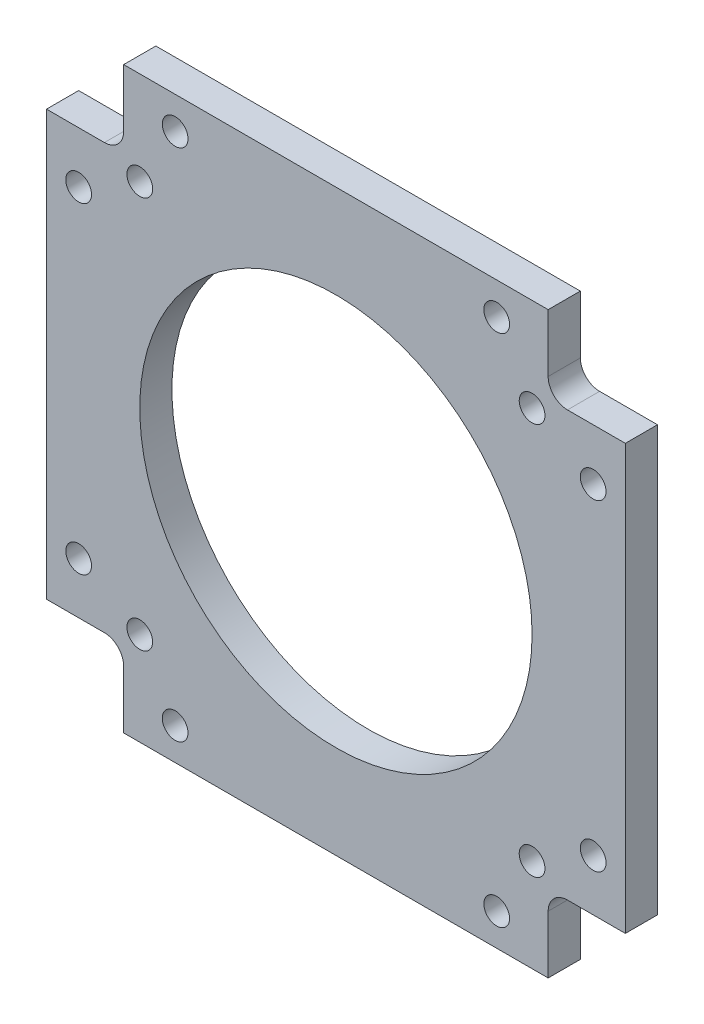
from build123d import *

# Parameters (mm, degrees)
SKETCH1_R           = 30.5
SKETCH1_R_2         = 2
BOSS_EXTRUDE1_DEPTH = 5
FILLET1_R           = 3
CUT_EXTRUDE1_REACH  = 65.836
SKETCH2_R           = 2


with BuildPart() as part:
    # Sketch1 → Boss-Extrude1 (new body)
    with BuildSketch(Plane.XY):
        Polygon((33, -45), (-33, -45), (-33, -33), (-45, -33), (-45, 33), (-33, 33), (-33, 45), (33, 45), (33, 33), (45, 33), (45, -33), (33, -33), align=None)
        Circle(SKETCH1_R, mode=Mode.SUBTRACT)
        with Locations((-30.5, 30.5)):
            Circle(SKETCH1_R_2, mode=Mode.SUBTRACT)
        with Locations(Location((30.5, 30.5, 0), (0, 0, 180))):
            Circle(SKETCH1_R_2, mode=Mode.SUBTRACT)
        with Locations((30.5, -30.5)):
            Circle(SKETCH1_R_2, mode=Mode.SUBTRACT)
        with Locations(Location((-30.5, -30.5, 0), (0, 0, 180))):
            Circle(SKETCH1_R_2, mode=Mode.SUBTRACT)
    extrude(amount=BOSS_EXTRUDE1_DEPTH)

    # Fillet1
    fillet1_edges = [part.edges().sort_by_distance(p)[0] for p in [
        (33, 33, 2.5),
        (33, -33, 2.5),
        (-33, -33, 2.5),
        (-33, 33, 2.5),
    ]]
    fillet(fillet1_edges, radius=FILLET1_R)

    # Sketch2 → Cut-Extrude1 (cut, up to next)
    with BuildSketch(Plane(origin=(0, 0, 0), x_dir=(-1, 0, 0), z_dir=(0, 0, -1)), mode=Mode.PRIVATE) as cut_extrude1_sk1:
        with Locations((-25, 40)):
            Circle(SKETCH2_R)
    cut_extrude1_tool1 = extrude(cut_extrude1_sk1.sketch, amount=-CUT_EXTRUDE1_REACH, mode=Mode.PRIVATE) & part.part
    # Sketch2 → Cut-Extrude1 (cut, up to next)
    with BuildSketch(Plane(origin=(0, 0, 0), x_dir=(-1, 0, 0), z_dir=(0, 0, -1)), mode=Mode.PRIVATE) as cut_extrude1_sk2:
        with Locations((40, 25)):
            Circle(SKETCH2_R)
    cut_extrude1_tool2 = extrude(cut_extrude1_sk2.sketch, amount=-CUT_EXTRUDE1_REACH, mode=Mode.PRIVATE) & part.part
    # Sketch2 → Cut-Extrude1 (cut, up to next)
    with BuildSketch(Plane(origin=(0, 0, 0), x_dir=(-1, 0, 0), z_dir=(0, 0, -1)), mode=Mode.PRIVATE) as cut_extrude1_sk3:
        with Locations((25, 40)):
            Circle(SKETCH2_R)
    cut_extrude1_tool3 = extrude(cut_extrude1_sk3.sketch, amount=-CUT_EXTRUDE1_REACH, mode=Mode.PRIVATE) & part.part
    # Sketch2 → Cut-Extrude1 (cut, up to next)
    with BuildSketch(Plane(origin=(0, 0, 0), x_dir=(-1, 0, 0), z_dir=(0, 0, -1)), mode=Mode.PRIVATE) as cut_extrude1_sk4:
        with Locations((25, -40)):
            Circle(SKETCH2_R)
    cut_extrude1_tool4 = extrude(cut_extrude1_sk4.sketch, amount=-CUT_EXTRUDE1_REACH, mode=Mode.PRIVATE) & part.part
    # Sketch2 → Cut-Extrude1 (cut, up to next)
    with BuildSketch(Plane(origin=(0, 0, 0), x_dir=(-1, 0, 0), z_dir=(0, 0, -1)), mode=Mode.PRIVATE) as cut_extrude1_sk5:
        with Locations((-25, -40)):
            Circle(SKETCH2_R)
    cut_extrude1_tool5 = extrude(cut_extrude1_sk5.sketch, amount=-CUT_EXTRUDE1_REACH, mode=Mode.PRIVATE) & part.part
    # Sketch2 → Cut-Extrude1 (cut, up to next)
    with BuildSketch(Plane(origin=(0, 0, 0), x_dir=(-1, 0, 0), z_dir=(0, 0, -1)), mode=Mode.PRIVATE) as cut_extrude1_sk6:
        with Locations((40, -25)):
            Circle(SKETCH2_R)
    cut_extrude1_tool6 = extrude(cut_extrude1_sk6.sketch, amount=-CUT_EXTRUDE1_REACH, mode=Mode.PRIVATE) & part.part
    # Sketch2 → Cut-Extrude1 (cut, up to next)
    with BuildSketch(Plane(origin=(0, 0, 0), x_dir=(-1, 0, 0), z_dir=(0, 0, -1)), mode=Mode.PRIVATE) as cut_extrude1_sk7:
        with Locations((-40, 25)):
            Circle(SKETCH2_R)
    cut_extrude1_tool7 = extrude(cut_extrude1_sk7.sketch, amount=-CUT_EXTRUDE1_REACH, mode=Mode.PRIVATE) & part.part
    # Sketch2 → Cut-Extrude1 (cut, up to next)
    with BuildSketch(Plane(origin=(0, 0, 0), x_dir=(-1, 0, 0), z_dir=(0, 0, -1)), mode=Mode.PRIVATE) as cut_extrude1_sk8:
        with Locations((-40, -25)):
            Circle(SKETCH2_R)
    cut_extrude1_tool8 = extrude(cut_extrude1_sk8.sketch, amount=-CUT_EXTRUDE1_REACH, mode=Mode.PRIVATE) & part.part
    add(cut_extrude1_tool1.solids().sort_by_distance((25, 40, 0))[0], mode=Mode.SUBTRACT)
    add(cut_extrude1_tool2.solids().sort_by_distance((-40, 25, 0))[0], mode=Mode.SUBTRACT)
    add(cut_extrude1_tool3.solids().sort_by_distance((-25, 40, 0))[0], mode=Mode.SUBTRACT)
    add(cut_extrude1_tool4.solids().sort_by_distance((-25, -40, 0))[0], mode=Mode.SUBTRACT)
    add(cut_extrude1_tool5.solids().sort_by_distance((25, -40, 0))[0], mode=Mode.SUBTRACT)
    add(cut_extrude1_tool6.solids().sort_by_distance((-40, -25, 0))[0], mode=Mode.SUBTRACT)
    add(cut_extrude1_tool7.solids().sort_by_distance((40, 25, 0))[0], mode=Mode.SUBTRACT)
    add(cut_extrude1_tool8.solids().sort_by_distance((40, -25, 0))[0], mode=Mode.SUBTRACT)


solid = part.part
